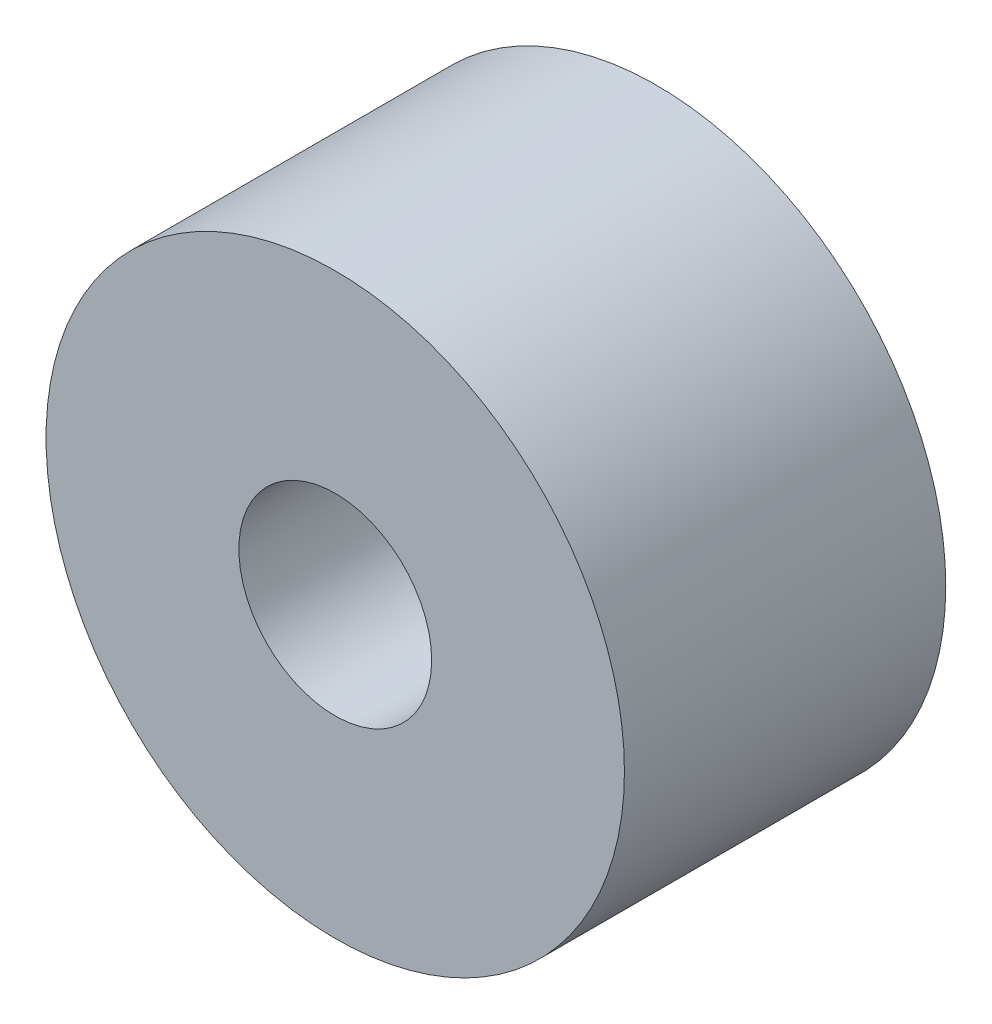
from build123d import *

# Parameters (mm, degrees)
SKETCH1_R           = 4.5
SKETCH1_R_2         = 1.5
BOSS_EXTRUDE1_DEPTH = 5


with BuildPart() as part:
    # Sketch1 → Boss-Extrude1 (new body)
    with BuildSketch(Plane.XY):
        Circle(SKETCH1_R)
        Circle(SKETCH1_R_2, mode=Mode.SUBTRACT)
    extrude(amount=BOSS_EXTRUDE1_DEPTH)


solid = part.part
